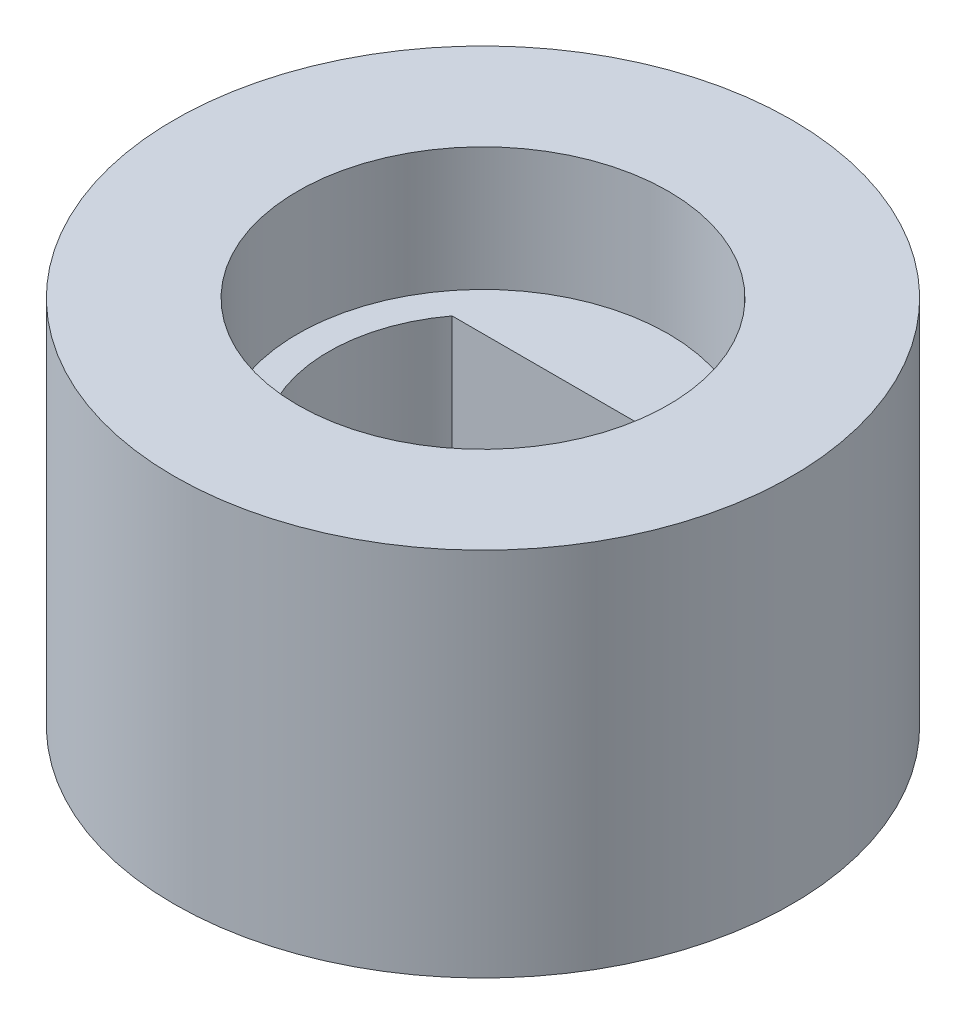
from build123d import *

# Parameters (mm, degrees)
SKETCH_1_R      = 5
SKETCH_1_R_2    = 3
EXTRUDE_1_DEPTH = 4
EXTRUDE_START   = 4
SKETCH_1_3_R    = 5
SKETCH_1_3_R_2  = 3
EXTRUDE_2_DEPTH = 2


with BuildPart() as part:
    # 草图1 → 凸台-拉伸1 (new body)
    # profile 1 of 2: a face of its own
    with BuildSketch(Plane(origin=(0, 0, 0), x_dir=(1, 0, 0), z_dir=(0, 1, 0))):
        with Locations(Location((0, 0, 0), (0, 0, 270))):
            Circle(SKETCH_1_R)
        Circle(SKETCH_1_R_2, mode=Mode.SUBTRACT)
    # profile 2 of 2: a face of its own
    with BuildSketch(Plane(origin=(0, 0, 0), x_dir=(1, 0, 0), z_dir=(0, 1, 0))):
        Circle(SKETCH_1_R_2)
        with BuildLine():
            ThreePointArc((-2, 1.5), (0, -2.5), (2, 1.5))
            Line((2, 1.5), (-2, 1.5))
        make_face(mode=Mode.SUBTRACT)
    extrude(amount=EXTRUDE_1_DEPTH)

    # 草图1<3> → 凸台-拉伸2 (add)
    with BuildSketch(Plane(origin=(0, 0, 0), x_dir=(1, 0, 0), z_dir=(0, 1, 0)).offset(EXTRUDE_START)):
        with Locations(Location((0, 0, 0), (0, 0, 270))):
            Circle(SKETCH_1_3_R)
        with Locations(Location((0, 0, 0), (0, 0, 270))):
            Circle(SKETCH_1_3_R_2, mode=Mode.SUBTRACT)
    extrude(amount=EXTRUDE_2_DEPTH)


solid = part.part
